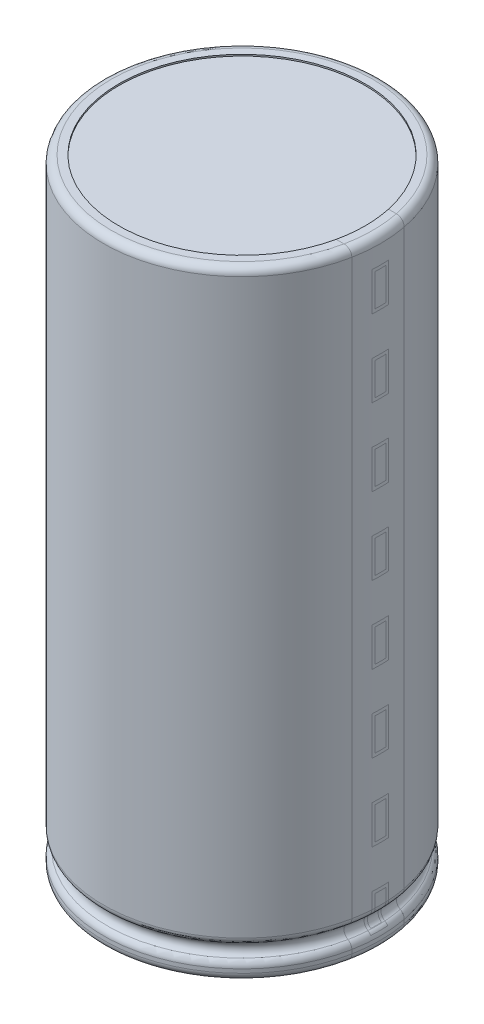
from build123d import *

# Parameters (mm, degrees)
BOSS_EXTRUDE1_DEPTH        = 1
BOSS_EXTRUDE1_DEPTH_BACK   = 3
SKETCH1_R                  = 0.4
BOSS_EXTRUDE1_2_DEPTH      = 1
BOSS_EXTRUDE1_2_DEPTH_BACK = 3


with BuildPart() as part:
    # Sketch1 → Boss-Extrude1 (new, two sides: drawn at the far end of the back side and taken through both)
    with BuildSketch(Plane(origin=(0, 0, 0), x_dir=(1, 0, 0), z_dir=(0, 1, 0)).offset(-BOSS_EXTRUDE1_DEPTH_BACK)):
        with Locations(Location((-3.75, 0, 0), (0, 0, 270))):
            Circle(SKETCH1_R)
    extrude(amount=BOSS_EXTRUDE1_DEPTH + BOSS_EXTRUDE1_DEPTH_BACK)



with BuildPart() as body_2:
    # Sketch1 → Boss-Extrude1 2 (new, two sides: drawn at the far end of the back side and taken through both)
    with BuildSketch(Plane(origin=(0, 0, 0), x_dir=(1, 0, 0), z_dir=(0, 1, 0)).offset(-BOSS_EXTRUDE1_2_DEPTH_BACK)):
        with Locations(Location((3.75, 0, 0), (0, 0, 90))):
            Circle(SKETCH1_R)
    extrude(amount=BOSS_EXTRUDE1_2_DEPTH + BOSS_EXTRUDE1_2_DEPTH_BACK)


with BuildPart() as part_1:
    add(part.part)

    add(body_2.part)  # Revolve1 merges body 2
    # Sketch3 → Revolve1 (revolve)
    with BuildSketch(Plane.XY):
        with BuildLine():
            Line((9, 0.5), (9, 0.75))
            ThreePointArc((9, 0.75), (8.933012702, 1), (8.75, 1.183012702))
            ThreePointArc((8.75, 1.183012702), (8.5, 1.616025404), (8.75, 2.049038106))
            ThreePointArc((8.75, 2.049038106), (8.933012702, 2.232050808), (9, 2.482050808))
            Line((9, 2.482050808), (9, 39.7))
            ThreePointArc((9, 39.7), (8.853553391, 40.053553391), (8.5, 40.2))
            Line((8.5, 40.2), (8, 40.2))
            Line((8, 40.2), (8, 40.1))
            Line((8, 40.1), (0, 40.1))
            Line((0, 40.1), (0, 0.1))
            Line((0, 0.1), (8, 0.1))
            Line((8, 0.1), (8, 0))
            Line((8, 0), (8.5, 0))
            ThreePointArc((8.5, 0), (8.853553391, 0.146446609), (9, 0.5))
        make_face()
    revolve(axis=Axis((0, 0.1, 0), (0, 1, 0)))


solid = part_1.part
